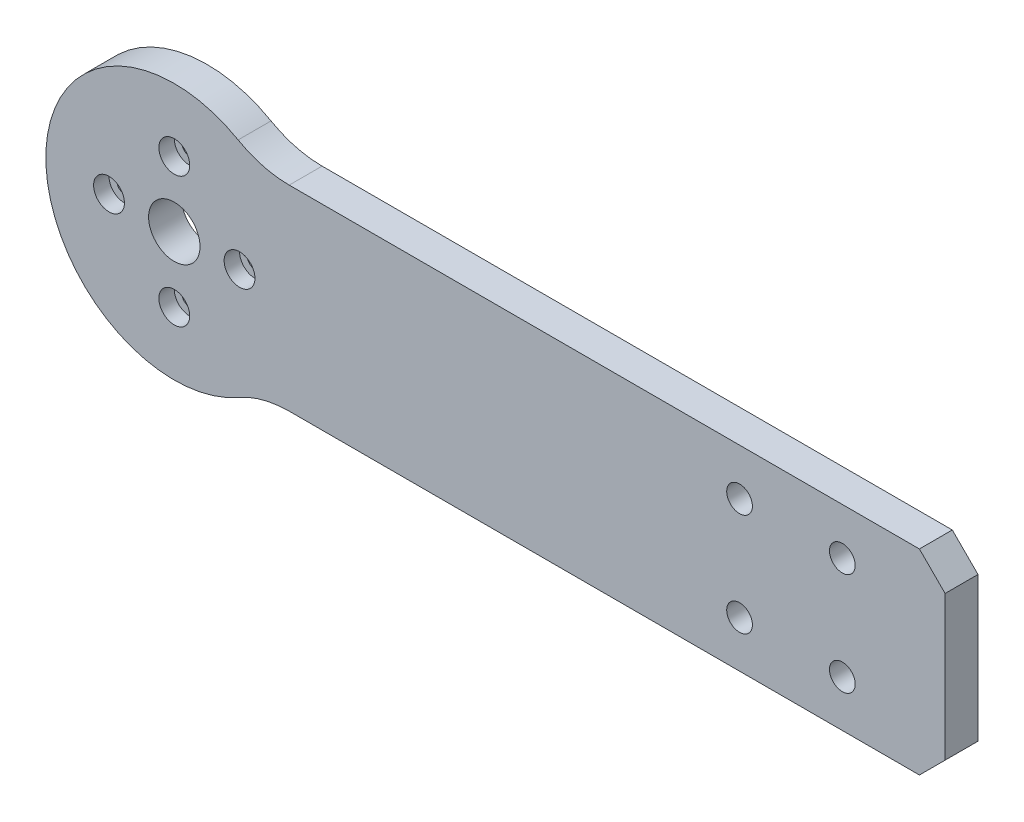
from build123d import *

# Parameters (mm, degrees)
SKETCH1_R           = 5
SKETCH1_R_2         = 2.5
SKETCH1_R_3         = 1.5
BOSS_EXTRUDE1_DEPTH = 6.4
SKETCH2_R           = 3
CUT_EXTRUDE1_DEPTH  = 3
CHAMFER1_SIZE       = 5
FILLET1_R           = 20


with BuildPart() as part:
    # Sketch1 → Boss-Extrude1 (new body)
    with BuildSketch(Plane.XY):
        with BuildLine():
            Line((150, 19.05), (16.189425561, 19.05))
            ThreePointArc((16.189425561, 19.05), (-25, 0), (16.189425561, -19.05))
            Line((16.189425561, -19.05), (150, -19.05))
            Line((150, -19.05), (150, 19.05))
        make_face()
        Circle(SKETCH1_R, mode=Mode.SUBTRACT)
        with Locations((130, 10)):
            Circle(SKETCH1_R_2, mode=Mode.SUBTRACT)
        with Locations((110, 10)):
            Circle(SKETCH1_R_2, mode=Mode.SUBTRACT)
        with Locations((110, -10)):
            Circle(SKETCH1_R_2, mode=Mode.SUBTRACT)
        with Locations((130, -10)):
            Circle(SKETCH1_R_2, mode=Mode.SUBTRACT)
        with Locations((0, 12.7)):
            Circle(SKETCH1_R_3, mode=Mode.SUBTRACT)
        with Locations((0, -12.7)):
            Circle(SKETCH1_R_3, mode=Mode.SUBTRACT)
        with Locations((12.7, 0)):
            Circle(SKETCH1_R_3, mode=Mode.SUBTRACT)
        with Locations((-12.7, 0)):
            Circle(SKETCH1_R_3, mode=Mode.SUBTRACT)
    extrude(amount=BOSS_EXTRUDE1_DEPTH)

    # Sketch2 → Cut-Extrude1 (cut)
    with BuildSketch(Plane.XY.offset(6.4)):
        with Locations((0, 12.7)):
            Circle(SKETCH2_R)
        with Locations((12.7, 0)):
            Circle(SKETCH2_R)
        with Locations((0, -12.7)):
            Circle(SKETCH2_R)
        with Locations((-12.7, 0)):
            Circle(SKETCH2_R)
    extrude(amount=-CUT_EXTRUDE1_DEPTH, mode=Mode.SUBTRACT)

    # Chamfer1
    chamfer1_edges = [part.edges().sort_by_distance(p)[0] for p in [
        (150, -19.05, 3.2),
        (150, 19.05, 3.2),
    ]]
    chamfer(chamfer1_edges, length=CHAMFER1_SIZE)

    # Fillet1
    fillet1_edges = [part.edges().sort_by_distance(p)[0] for p in [
        (16.189425561, -19.05, 3.2),
        (16.189425561, 19.05, 3.2),
    ]]
    fillet(fillet1_edges, radius=FILLET1_R)


solid = part.part
